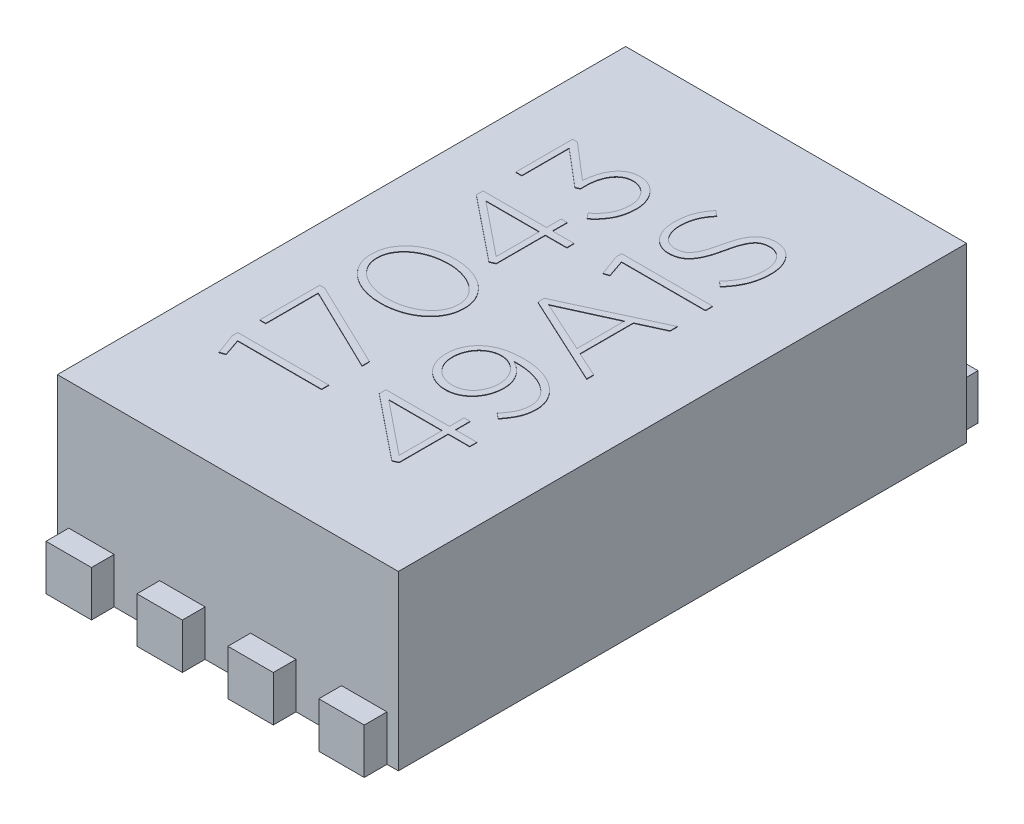
from build123d import *

# Parameters (mm, degrees)
SKETCH1_W           = 1.905
SKETCH1_H           = 3.175
BOSS_EXTRUDE1_DEPTH = 0.9652
SKETCH2_W           = 0.254
SKETCH2_H           = 0.254
BOSS_EXTRUDE2_DEPTH = 0.127
BOSS_EXTRUDE3_DEPTH = 0.00254


with BuildPart() as part:
    # Sketch1 → Boss-Extrude1 (new body)
    with BuildSketch(Plane(origin=(0, 0, 0), x_dir=(1, 0, 0), z_dir=(0, 1, 0))):
        Rectangle(SKETCH1_W, SKETCH1_H)
    extrude(amount=BOSS_EXTRUDE1_DEPTH)

    # Sketch2 → Boss-Extrude2 (add)
    with BuildSketch(Plane.XY.offset(1.5875)):
        with Locations((-0.762, 0.127)):
            Rectangle(SKETCH2_W, SKETCH2_H)
        with Locations((-0.254, 0.127)):
            Rectangle(SKETCH2_W, SKETCH2_H)
        with Locations((0.254, 0.127)):
            Rectangle(SKETCH2_W, SKETCH2_H)
        with Locations((0.762, 0.127)):
            Rectangle(SKETCH2_W, SKETCH2_H)
    boss_extrude2 = extrude(amount=BOSS_EXTRUDE2_DEPTH)

    # Mirror1: Boss-Extrude2 across plane
    add(boss_extrude2.mirror(Plane.XY))

    # Sketch3 → Boss-Extrude3 (add)
    # profile 1 of 10: a face of its own
    with BuildSketch(Plane(origin=(0, 0.9652, 0), x_dir=(1, 0, 0), z_dir=(0, 1, 0))):
        Polygon((-0.610505972, -0.922421053), (-0.577293801, -1.019864309), (-0.606850545, -1.029995066), (-0.649462387, -0.913752467), (-0.649462387, -0.882315789), (-0.141462387, -0.882315789), (-0.141462387, -0.922421053), align=None)
    # profile 2 of 10: a face of its own
    with BuildSketch(Plane(origin=(0, 0.9652, 0), x_dir=(1, 0, 0), z_dir=(0, 1, 0))):
        Polygon((-0.616041334, -0.466641447), (-0.616041334, -0.759702303), (-0.649462387, -0.759702303), (-0.649462387, -0.424760691), (-0.621890018, -0.424760691), (-0.141462387, -0.655052632), (-0.141462387, -0.696202303), align=None)
    # profile 3 of 10: a face of its own
    with BuildSketch(Plane(origin=(0, 0.9652, 0), x_dir=(1, 0, 0), z_dir=(0, 1, 0))):
        with BuildLine():
            add(Edge.make_bspline(
                [(-0.134778176, -0.131073191), (-0.134985946, -0.138995189), (-0.135393274, -0.154526071), (-0.139575216, -0.177158237), (-0.145938838, -0.198666452), (-0.155274919, -0.218747049), (-0.166706269, -0.237440209), (-0.179953796, -0.254852705), (-0.195136491, -0.270736797), (-0.212129513, -0.285058077), (-0.230738412, -0.297831511), (-0.250787447, -0.309116717), (-0.272341137, -0.318743469), (-0.295135788, -0.32669989), (-0.318896259, -0.333103481), (-0.343424456, -0.337534553), (-0.368520942, -0.340343484), (-0.385463471, -0.340710041), (-0.394000216, -0.340894737)],
                knots=[0, 0, 0, 0, 1.021048874, 2.001741057, 2.959440883, 3.908123775, 4.849483788, 5.782004241, 6.725579915, 7.678559664, 8.64415859, 9.633647405, 10.642930682, 11.685653277, 12.745789764, 13.814456005, 14.898781227, 16, 16, 16, 16], degree=3))
            Line((-0.394000216, -0.340894737), (-0.395462387, -0.340894737))
            add(Edge.make_bspline(
                [(-0.395462387, -0.340894737), (-0.403999736, -0.340717614), (-0.420981891, -0.340365289), (-0.446147785, -0.337430896), (-0.47083629, -0.332855038), (-0.494814242, -0.326451352), (-0.517748672, -0.318204595), (-0.539397375, -0.308418706), (-0.559470827, -0.296850085), (-0.578174818, -0.283949742), (-0.595094912, -0.269372102), (-0.610393477, -0.25347287), (-0.623644674, -0.235959959), (-0.635360911, -0.217327312), (-0.64475705, -0.197203548), (-0.65128088, -0.175715858), (-0.655392504, -0.15305806), (-0.655891857, -0.137531667), (-0.656146597, -0.12961102)],
                knots=[0, 0, 0, 0, 1.096222778, 2.180562826, 3.249592639, 4.319033819, 5.364233402, 6.376698445, 7.366113132, 8.336100033, 9.290555337, 10.229850209, 11.164407819, 12.106179152, 13.052429817, 14.007094568, 14.98333756, 16, 16, 16, 16], degree=3))
            add(Edge.make_bspline(
                [(-0.656146597, -0.12961102), (-0.655874869, -0.121693731), (-0.655341244, -0.106145585), (-0.651465207, -0.083445593), (-0.644788249, -0.062040336), (-0.635689141, -0.041906193), (-0.624206096, -0.023248911), (-0.611004254, -0.005869499), (-0.595857302, 0.009982987), (-0.578858223, 0.024295176), (-0.56024998, 0.037098012), (-0.540222687, 0.048461037), (-0.518685112, 0.05805269), (-0.495864575, 0.066036568), (-0.472058696, 0.072402496), (-0.447501117, 0.07685327), (-0.422403627, 0.079658523), (-0.405461234, 0.08002558), (-0.396924558, 0.080210526)],
                knots=[0, 0, 0, 0, 1.021334821, 2.005719747, 2.960480962, 3.907337291, 4.848733233, 5.781289277, 6.718550215, 7.671566337, 8.643450498, 9.629064498, 10.638386295, 11.681148687, 12.745665563, 13.81437259, 14.898739198, 16, 16, 16, 16], degree=3))
            Line((-0.396924558, 0.080210526), (-0.395462387, 0.080210526))
            add(Edge.make_bspline(
                [(-0.395462387, 0.080210526), (-0.386924746, 0.080034493), (-0.369942011, 0.079684334), (-0.34478041, 0.076733907), (-0.320099959, 0.072222423), (-0.296172697, 0.065597874), (-0.273227482, 0.057423738), (-0.251502563, 0.047752778), (-0.231457029, 0.036159337), (-0.212749612, 0.023266935), (-0.195828267, 0.008688633), (-0.180537878, -0.007215591), (-0.167266457, -0.024693411), (-0.155675765, -0.043386678), (-0.146319961, -0.063469285), (-0.139579231, -0.084904939), (-0.135553242, -0.107596729), (-0.135039619, -0.123154191), (-0.134778176, -0.131073191)],
                knots=[0, 0, 0, 0, 1.096336923, 2.180789878, 3.249931005, 4.316337847, 5.365856055, 6.376578305, 7.366096015, 8.336183917, 9.290738604, 10.230131281, 11.164786202, 12.104306594, 13.050655788, 14.00248317, 14.983231699, 16, 16, 16, 16], degree=3))
        make_face()
        with BuildLine():
            add(Edge.make_bspline(
                [(-0.168199229, -0.12961102), (-0.168400432, -0.123256589), (-0.168796191, -0.110757625), (-0.172512027, -0.092535103), (-0.178324661, -0.075203262), (-0.186714231, -0.059022885), (-0.196884296, -0.043885216), (-0.208610262, -0.029770825), (-0.222109792, -0.01701095), (-0.237056529, -0.00540985), (-0.253425086, 0.004871185), (-0.270871239, 0.014127427), (-0.289592828, 0.02195357), (-0.309332573, 0.028465042), (-0.329852898, 0.033674841), (-0.350858085, 0.037442764), (-0.372296771, 0.039690301), (-0.386718853, 0.039966046), (-0.394000216, 0.040105263)],
                knots=[0, 0, 0, 0, 0.971998841, 1.911890973, 2.835726599, 3.763154361, 4.693152536, 5.624158575, 6.566813259, 7.531843225, 8.516795651, 9.523098662, 10.552795509, 11.619899711, 12.70338974, 13.791956286, 14.885211918, 16, 16, 16, 16], degree=3))
            Line((-0.394000216, 0.040105263), (-0.395462387, 0.040105263))
            add(Edge.make_bspline(
                [(-0.395462387, 0.040105263), (-0.402743629, 0.039964791), (-0.417200111, 0.039685893), (-0.438708948, 0.037445187), (-0.459849056, 0.033660251), (-0.480515039, 0.028479891), (-0.500439198, 0.021951412), (-0.519293517, 0.014034141), (-0.536885436, 0.00470017), (-0.553249138, -0.005834789), (-0.568160696, -0.017641563), (-0.581737713, -0.030529966), (-0.593471743, -0.044848708), (-0.603916483, -0.060027411), (-0.612383375, -0.076353885), (-0.618302622, -0.093782518), (-0.622155633, -0.112105114), (-0.622533533, -0.124682582), (-0.622725545, -0.131073191)],
                knots=[0, 0, 0, 0, 1.107273849, 2.19842768, 3.284869194, 4.371323612, 5.436262208, 6.470833719, 7.477509033, 8.461537381, 9.426592335, 10.36655408, 11.30280988, 12.23684706, 13.165148402, 14.089484759, 15.029267521, 16, 16, 16, 16], degree=3))
            add(Edge.make_bspline(
                [(-0.622725545, -0.131073191), (-0.62252351, -0.137427186), (-0.622126113, -0.149925294), (-0.618422174, -0.168154038), (-0.612570389, -0.185447828), (-0.604347666, -0.201719286), (-0.594056551, -0.216760168), (-0.582255086, -0.230821002), (-0.568861712, -0.243644177), (-0.553959197, -0.255303472), (-0.53759999, -0.265547975), (-0.520136246, -0.274841924), (-0.50138368, -0.282592965), (-0.481668262, -0.289160312), (-0.46115584, -0.294413937), (-0.440079969, -0.297940202), (-0.418637304, -0.300421209), (-0.404207816, -0.300665944), (-0.396924558, -0.300789474)],
                knots=[0, 0, 0, 0, 0.971956183, 1.911807067, 2.83560215, 3.760580748, 4.693512614, 5.620393957, 6.566692983, 7.527475195, 8.512384395, 9.518643244, 10.553209405, 11.615208307, 12.698650787, 13.791494471, 14.885260842, 16, 16, 16, 16], degree=3))
            Line((-0.396924558, -0.300789474), (-0.395462387, -0.300789474))
            add(Edge.make_bspline(
                [(-0.395462387, -0.300789474), (-0.388179172, -0.300665494), (-0.373749771, -0.300419866), (-0.352340577, -0.297949392), (-0.331300577, -0.294406592), (-0.310800614, -0.289128661), (-0.290997064, -0.282656644), (-0.272243242, -0.274642628), (-0.254532157, -0.265516106), (-0.238101117, -0.254945658), (-0.223039123, -0.243121239), (-0.209334286, -0.230188579), (-0.197446113, -0.215869336), (-0.18701646, -0.200651754), (-0.178512978, -0.184305861), (-0.172659129, -0.166856132), (-0.168755751, -0.14854784), (-0.168387067, -0.136002612), (-0.168199229, -0.12961102)],
                knots=[0, 0, 0, 0, 1.107665828, 2.194491947, 3.275182509, 4.351750245, 5.41203684, 6.442096919, 7.451355009, 8.440182223, 9.409740304, 10.36135003, 11.301331171, 12.235699005, 13.164328968, 14.0940007, 15.028923878, 16, 16, 16, 16], degree=3))
        make_face(mode=Mode.SUBTRACT)
    # profile 4 of 10: a face of its own
    with BuildSketch(Plane(origin=(0, 0.9652, 0), x_dir=(1, 0, 0), z_dir=(0, 1, 0))):
        Polygon((-0.261778176, 0.447842105), (-0.261778176, 0.174207237), (-0.29008163, 0.161256579), (-0.649462387, 0.450244243), (-0.649462387, 0.487947368), (-0.295199229, 0.487947368), (-0.295199229, 0.570246711), (-0.261778176, 0.570246711), (-0.261778176, 0.487947368), (-0.141462387, 0.487947368), (-0.141462387, 0.447842105), align=None)
        Polygon((-0.295199229, 0.447842105), (-0.594108768, 0.447842105), (-0.295199229, 0.206688322), align=None, mode=Mode.SUBTRACT)
    # profile 5 of 10: a face of its own
    with BuildSketch(Plane(origin=(0, 0.9652, 0), x_dir=(1, 0, 0), z_dir=(0, 1, 0))):
        with BuildLine():
            add(Edge.make_bspline(
                [(-0.134778176, 0.830304276), (-0.134867002, 0.825219697), (-0.135042446, 0.815176887), (-0.136175177, 0.800350138), (-0.138189371, 0.786027667), (-0.140850993, 0.772195239), (-0.144464281, 0.758893557), (-0.148689746, 0.746021318), (-0.153840591, 0.733688223), (-0.161617326, 0.718024636), (-0.172888349, 0.699658447), (-0.188257588, 0.679252694), (-0.205685459, 0.660789534), (-0.21869924, 0.650081587), (-0.2252239, 0.644712993)],
                knots=[0, 0, 0, 0, 0.854271504, 1.687314925, 2.496294613, 3.283194386, 4.052173996, 4.81051404, 5.55783425, 6.295478513, 7.746980402, 9.170639424, 10.581456551, 12, 12, 12, 12], degree=3))
            Line((-0.2252239, 0.644712993), (-0.2490364, 0.673643092))
            add(Edge.make_bspline(
                [(-0.2490364, 0.673643092), (-0.242797709, 0.678740743), (-0.230567899, 0.688733753), (-0.214427255, 0.705586165), (-0.200540932, 0.723442203), (-0.188792354, 0.742345209), (-0.179493171, 0.762555595), (-0.172894428, 0.784147866), (-0.168982917, 0.80715069), (-0.168464742, 0.822943253), (-0.168199229, 0.831035362)],
                knots=[0, 0, 0, 0, 1.051624329, 2.061516695, 3.040294683, 4.001988714, 4.962466983, 5.937752461, 6.943304406, 8, 8, 8, 8], degree=3))
            add(Edge.make_bspline(
                [(-0.168199229, 0.831035362), (-0.168293367, 0.835184146), (-0.168479952, 0.843407199), (-0.170165499, 0.85558325), (-0.172549831, 0.867510905), (-0.176322248, 0.878982874), (-0.180706509, 0.889983545), (-0.186013794, 0.900290874), (-0.191896524, 0.909954103), (-0.198768176, 0.918742821), (-0.20627827, 0.9268256), (-0.214590728, 0.934094993), (-0.223692386, 0.940468124), (-0.233522668, 0.945911033), (-0.243987999, 0.95029971), (-0.255031239, 0.953604773), (-0.266726239, 0.955492832), (-0.27472216, 0.955724102), (-0.278802025, 0.955842105)],
                knots=[0, 0, 0, 0, 1.071579575, 2.123913014, 3.172045966, 4.210597515, 5.239753758, 6.229579871, 7.203287384, 8.158870018, 9.107310552, 10.051002544, 11.006966285, 11.97345626, 12.949281299, 13.934270765, 14.945975694, 16, 16, 16, 16], degree=3))
            Line((-0.278802025, 0.955842105), (-0.280264196, 0.955842105))
            add(Edge.make_bspline(
                [(-0.280264196, 0.955842105), (-0.284555501, 0.955707495), (-0.292918761, 0.955445156), (-0.305059697, 0.953232066), (-0.316369607, 0.949429391), (-0.326834587, 0.944158344), (-0.336547689, 0.937655973), (-0.345306052, 0.929784746), (-0.353534408, 0.921029759), (-0.360836765, 0.911037766), (-0.367269945, 0.900004192), (-0.37309996, 0.888076865), (-0.377821071, 0.875015622), (-0.381900393, 0.861111472), (-0.385011227, 0.846372838), (-0.387150839, 0.830980468), (-0.388579316, 0.814978431), (-0.388711117, 0.804092824), (-0.388778176, 0.798554276)],
                knots=[0, 0, 0, 0, 0.96348038, 1.87771215, 2.760599961, 3.634960617, 4.502580198, 5.378059321, 6.274524208, 7.197378641, 8.151001125, 9.140876251, 10.175197234, 11.266629109, 12.394005205, 13.555293097, 14.756143983, 16, 16, 16, 16], degree=3))
            Line((-0.388778176, 0.798554276), (-0.388778176, 0.771086349))
            Line((-0.388778176, 0.771086349), (-0.410292979, 0.761686678))
            Line((-0.410292979, 0.761686678), (-0.616041334, 0.935685033))
            Line((-0.616041334, 0.935685033), (-0.616041334, 0.67071875))
            Line((-0.616041334, 0.67071875), (-0.649462387, 0.67071875))
            Line((-0.649462387, 0.67071875), (-0.649462387, 0.987800987))
            Line((-0.649462387, 0.987800987), (-0.622203341, 0.987800987))
            Line((-0.622203341, 0.987800987), (-0.422199229, 0.815787007))
            add(Edge.make_bspline(
                [(-0.422199229, 0.815787007), (-0.42173515, 0.821745616), (-0.420817997, 0.833521525), (-0.418440916, 0.850940754), (-0.414928485, 0.86786225), (-0.410715985, 0.884313074), (-0.405583515, 0.900073227), (-0.399240673, 0.91482587), (-0.392160146, 0.928692023), (-0.384113429, 0.941594413), (-0.375081675, 0.953439558), (-0.364820744, 0.963998475), (-0.353513315, 0.973268284), (-0.341259689, 0.98145032), (-0.327814179, 0.987939281), (-0.313259771, 0.992711481), (-0.297596194, 0.995399101), (-0.286819102, 0.995761876), (-0.281308604, 0.995947368)],
                knots=[0, 0, 0, 0, 1.129077432, 2.231378806, 3.318822516, 4.392492957, 5.438734542, 6.446643788, 7.423313533, 8.377804221, 9.315835361, 10.232192388, 11.152694783, 12.073972357, 13.009463343, 13.964203295, 14.959064901, 16, 16, 16, 16], degree=3))
            Line((-0.281308604, 0.995947368), (-0.279950874, 0.995947368))
            add(Edge.make_bspline(
                [(-0.279950874, 0.995947368), (-0.274612313, 0.995803964), (-0.264112347, 0.995521914), (-0.248770236, 0.992782266), (-0.23413713, 0.988578214), (-0.220441855, 0.982405122), (-0.207585945, 0.974944502), (-0.195488028, 0.96642286), (-0.184530835, 0.956503503), (-0.174452731, 0.945604586), (-0.165390889, 0.933719257), (-0.157381272, 0.92090344), (-0.150635777, 0.9071489), (-0.144865665, 0.89267855), (-0.140436713, 0.877593613), (-0.137177341, 0.862128989), (-0.135107269, 0.84634001), (-0.134888333, 0.835671883), (-0.134778176, 0.830304276)],
                knots=[0, 0, 0, 0, 1.044950902, 2.05522634, 3.043647224, 4.020779072, 4.989423835, 5.952747326, 6.913943739, 7.879269157, 8.85735268, 9.837692728, 10.835108811, 11.854665746, 12.886197601, 13.910851897, 14.948857301, 16, 16, 16, 16], degree=3))
        make_face()
    # profile 6 of 10: a face of its own
    with BuildSketch(Plane(origin=(0, 0.9652, 0), x_dir=(1, 0, 0), z_dir=(0, 1, 0))):
        Polygon((0.42900315, -0.785394737), (0.42900315, -1.059029605), (0.400699696, -1.071980263), (0.04131894, -0.782992599), (0.04131894, -0.745289474), (0.395582098, -0.745289474), (0.395582098, -0.662990132), (0.42900315, -0.662990132), (0.42900315, -0.745289474), (0.54931894, -0.745289474), (0.54931894, -0.785394737), align=None)
        Polygon((0.395582098, -0.785394737), (0.096672558, -0.785394737), (0.395582098, -1.02654852), align=None, mode=Mode.SUBTRACT)
    # profile 7 of 10: a face of its own
    with BuildSketch(Plane(origin=(0, 0.9652, 0), x_dir=(1, 0, 0), z_dir=(0, 1, 0))):
        with BuildLine():
            add(Edge.make_bspline(
                [(0.55600315, -0.418912007), (0.555788983, -0.426619426), (0.555371128, -0.441657157), (0.55192798, -0.463505303), (0.546523937, -0.484044169), (0.538422694, -0.503058187), (0.528917712, -0.521056137), (0.518359796, -0.538435194), (0.506642015, -0.55519409), (0.498065823, -0.565838202), (0.49375644, -0.571186678)],
                knots=[0, 0, 0, 0, 1.099009896, 2.144247589, 3.147899211, 4.121001419, 5.085164562, 6.050261124, 7.020291078, 8, 8, 8, 8], degree=3))
            Line((0.49375644, -0.571186678), (0.464826341, -0.547374178))
            add(Edge.make_bspline(
                [(0.464826341, -0.547374178), (0.469429137, -0.542040524), (0.478346081, -0.531707699), (0.490059943, -0.515648096), (0.500034267, -0.499858281), (0.50838724, -0.484193501), (0.5146661, -0.468232399), (0.519381212, -0.452003096), (0.521991135, -0.435219521), (0.522383785, -0.423898671), (0.522582098, -0.418180921)],
                knots=[0, 0, 0, 0, 1.166578334, 2.259998627, 3.288750388, 4.258584942, 5.195563713, 6.124701817, 7.05285518, 8, 8, 8, 8], degree=3))
            add(Edge.make_bspline(
                [(0.522582098, -0.418180921), (0.522339535, -0.411930998), (0.521859652, -0.399566213), (0.518085819, -0.381493559), (0.511992742, -0.364210033), (0.503306491, -0.347936485), (0.492663528, -0.332570566), (0.479990604, -0.318347786), (0.465368048, -0.305374702), (0.448920533, -0.293608693), (0.430813341, -0.28299926), (0.41091851, -0.273971047), (0.389485958, -0.26613286), (0.366505785, -0.259716389), (0.342167198, -0.254648037), (0.316533218, -0.251490398), (0.289729512, -0.249964617), (0.271507388, -0.250423693), (0.262211209, -0.250657895)],
                knots=[0, 0, 0, 0, 0.868006066, 1.717254597, 2.554342617, 3.407043532, 4.272727134, 5.146646299, 6.047889427, 6.983804171, 7.953042507, 8.959718696, 10.015873201, 11.121769014, 12.272774416, 13.467618061, 14.708082809, 16, 16, 16, 16], degree=3))
            add(Edge.make_bspline(
                [(0.262211209, -0.250657895), (0.268803567, -0.25439114), (0.282095791, -0.261918512), (0.29750446, -0.27336064), (0.309182874, -0.283456838), (0.317479075, -0.291631731), (0.32518657, -0.300394368), (0.332342863, -0.309722659), (0.338786659, -0.319665238), (0.344693889, -0.330127768), (0.349802659, -0.341242972), (0.354189496, -0.352928428), (0.357778835, -0.365238516), (0.36041284, -0.378188901), (0.36183944, -0.391829602), (0.362052423, -0.40111917), (0.362161045, -0.405856908)],
                knots=[0, 0, 0, 0, 1.632992267, 3.292615584, 4.128309955, 4.961977577, 5.802616828, 6.643691982, 7.495559133, 8.356217987, 9.233135799, 10.131368654, 11.046302244, 11.996191627, 12.978045202, 14, 14, 14, 14], degree=3))
            add(Edge.make_bspline(
                [(0.362161045, -0.405856908), (0.36203581, -0.41202684), (0.361789384, -0.424167443), (0.359389983, -0.441986203), (0.355690248, -0.459060356), (0.350420986, -0.475253066), (0.343984361, -0.49056086), (0.336221209, -0.504756068), (0.327421764, -0.517968002), (0.317391382, -0.529925361), (0.306392943, -0.540761166), (0.294387973, -0.55029841), (0.281553332, -0.55868735), (0.267835255, -0.565699329), (0.253414654, -0.571246584), (0.238360354, -0.575224837), (0.222744246, -0.577694286), (0.212123483, -0.578019678), (0.20675315, -0.578184211)],
                knots=[0, 0, 0, 0, 1.142927878, 2.248944502, 3.325994144, 4.376827604, 5.40026555, 6.399249087, 7.370960484, 8.337517104, 9.286535453, 10.227690973, 11.174403504, 12.123772724, 13.077582413, 14.032264635, 15.005025107, 16, 16, 16, 16], degree=3))
            Line((0.20675315, -0.578184211), (0.205290979, -0.578184211))
            add(Edge.make_bspline(
                [(0.205290979, -0.578184211), (0.199538647, -0.578018113), (0.188157569, -0.577689487), (0.171318852, -0.575229589), (0.154960586, -0.571124999), (0.139116919, -0.565495475), (0.123981117, -0.558435291), (0.10982072, -0.549896403), (0.096608866, -0.540174674), (0.084436464, -0.529179659), (0.073455178, -0.516895567), (0.063617664, -0.503505553), (0.055006154, -0.488993069), (0.047684297, -0.473413802), (0.041800816, -0.456776642), (0.037671109, -0.439162063), (0.035085431, -0.420659778), (0.034787031, -0.408024065), (0.034634729, -0.401574836)],
                knots=[0, 0, 0, 0, 1.006957659, 1.992281052, 2.972462474, 3.955728526, 4.931959578, 5.891626713, 6.846227761, 7.799972106, 8.758244375, 9.726276879, 10.704769951, 11.708253038, 12.735811435, 13.788501064, 14.871257679, 16, 16, 16, 16], degree=3))
            add(Edge.make_bspline(
                [(0.034634729, -0.401574836), (0.034762149, -0.394913598), (0.035010791, -0.381915161), (0.037905886, -0.363055402), (0.042022445, -0.345234634), (0.048330545, -0.328678689), (0.055948291, -0.313219952), (0.06477045, -0.298888461), (0.07454557, -0.285561616), (0.082067497, -0.277667664), (0.085810716, -0.273739309)],
                knots=[0, 0, 0, 0, 1.129293469, 2.203652218, 3.23095411, 4.227267122, 5.202123363, 6.151444167, 7.080082873, 8, 8, 8, 8], degree=3))
            add(Edge.make_bspline(
                [(0.085810716, -0.273739309), (0.090827868, -0.269026004), (0.1010318, -0.259440037), (0.115497587, -0.24917815), (0.128100838, -0.241728126), (0.138256769, -0.236361274), (0.149223587, -0.231744834), (0.160753999, -0.227290223), (0.173042949, -0.223309047), (0.186185256, -0.220028293), (0.200075238, -0.21707368), (0.214821239, -0.214696728), (0.230430583, -0.212829214), (0.246941227, -0.211451834), (0.264364149, -0.210782596), (0.276275478, -0.210630454), (0.282368282, -0.210552632)],
                knots=[0, 0, 0, 0, 1.36137028, 2.768767971, 3.497908331, 4.259161636, 5.039997446, 5.851340597, 6.705559102, 7.594666812, 8.531212599, 9.515635712, 10.549807531, 11.642209477, 12.793958774, 14, 14, 14, 14], degree=3))
            Line((0.282368282, -0.210552632), (0.283830453, -0.210552632))
            add(Edge.make_bspline(
                [(0.283830453, -0.210552632), (0.29358766, -0.21074185), (0.312736251, -0.211113194), (0.340767767, -0.214363204), (0.367600381, -0.219370865), (0.393008441, -0.226766542), (0.417027269, -0.235709062), (0.43947482, -0.246147826), (0.460216618, -0.25808722), (0.479304891, -0.271350196), (0.496552828, -0.285930512), (0.511834718, -0.301804405), (0.525054333, -0.31888182), (0.536170603, -0.337074761), (0.545025888, -0.356303394), (0.551422541, -0.376422754), (0.555303239, -0.39742195), (0.555767911, -0.411689233), (0.55600315, -0.418912007)],
                knots=[0, 0, 0, 0, 1.230396351, 2.414661871, 3.554974421, 4.669716749, 5.748053625, 6.785371207, 7.78870504, 8.763305362, 9.713579913, 10.632919843, 11.537659183, 12.432399557, 13.316657273, 14.201351068, 15.089438924, 16, 16, 16, 16], degree=3))
        make_face()
        with BuildLine():
            add(Edge.make_bspline(
                [(0.328739992, -0.39948602), (0.328597372, -0.394152631), (0.328318452, -0.3837222), (0.326197147, -0.368459471), (0.322680452, -0.354031261), (0.317711418, -0.340486912), (0.311645102, -0.327855529), (0.304665156, -0.316132398), (0.296743567, -0.305404915), (0.288112112, -0.295582214), (0.278710069, -0.28678946), (0.268593152, -0.279098779), (0.257851298, -0.272513441), (0.246514004, -0.267119544), (0.234916412, -0.262666365), (0.223050499, -0.259717729), (0.211139534, -0.257687046), (0.203140991, -0.25745733), (0.199128973, -0.257342105)],
                knots=[0, 0, 0, 0, 1.197831748, 2.34258199, 3.454124339, 4.527881334, 5.577295426, 6.597990225, 7.588146042, 8.568867451, 9.531681962, 10.474889345, 11.419166106, 12.356616915, 13.292108305, 14.204495941, 15.099386472, 16, 16, 16, 16], degree=3))
            Line((0.199128973, -0.257342105), (0.197666801, -0.257342105))
            add(Edge.make_bspline(
                [(0.197666801, -0.257342105), (0.193238669, -0.257497522), (0.184477583, -0.257805015), (0.171503139, -0.25981397), (0.158964801, -0.263264174), (0.146945405, -0.268096381), (0.135586726, -0.274080742), (0.124803514, -0.280965276), (0.114922433, -0.289088114), (0.10563984, -0.29803314), (0.097414661, -0.308164037), (0.089918539, -0.319160668), (0.083486243, -0.331231228), (0.077908735, -0.344165844), (0.073619013, -0.357904932), (0.070278527, -0.372233174), (0.068421541, -0.387147548), (0.068178534, -0.39728801), (0.068055782, -0.402410362)],
                knots=[0, 0, 0, 0, 0.98046618, 1.939857778, 2.899218408, 3.85398461, 4.802162155, 5.738674229, 6.681320796, 7.629811633, 8.58818074, 9.56524715, 10.572350965, 11.611856617, 12.679644669, 13.754891426, 14.865906145, 16, 16, 16, 16], degree=3))
            add(Edge.make_bspline(
                [(0.068055782, -0.402410362), (0.068198434, -0.407535064), (0.068477211, -0.417549935), (0.070594447, -0.432191447), (0.074136182, -0.446023234), (0.079065129, -0.458991962), (0.085163025, -0.471079061), (0.092258812, -0.482190905), (0.100159918, -0.492497623), (0.109028187, -0.501764653), (0.118771615, -0.510043289), (0.129299594, -0.517263044), (0.140516614, -0.523611319), (0.152495684, -0.528725211), (0.164898725, -0.532982505), (0.177620347, -0.535821509), (0.190508649, -0.537711236), (0.19915706, -0.537955732), (0.203515486, -0.538078947)],
                knots=[0, 0, 0, 0, 1.14951129, 2.246415069, 3.311114252, 4.346912692, 5.352950193, 6.343217722, 7.300943857, 8.262230798, 9.215359209, 10.164349909, 11.122553705, 12.102042322, 13.082651494, 14.060363273, 15.022506651, 16, 16, 16, 16], degree=3))
            Line((0.203515486, -0.538078947), (0.204977657, -0.538078947))
            add(Edge.make_bspline(
                [(0.204977657, -0.538078947), (0.209369636, -0.537956236), (0.218055339, -0.537713557), (0.230793221, -0.535861268), (0.24292813, -0.532505454), (0.254542996, -0.5282142), (0.265418313, -0.522496278), (0.275608729, -0.515790022), (0.285053012, -0.508043958), (0.293628685, -0.499220344), (0.301361617, -0.489471324), (0.308272947, -0.478872654), (0.31433497, -0.467484486), (0.319458671, -0.455283922), (0.323680291, -0.442385227), (0.326554576, -0.428691496), (0.328379984, -0.414331105), (0.32861828, -0.404504889), (0.328739992, -0.39948602)],
                knots=[0, 0, 0, 0, 1.014777876, 2.006853222, 2.965014428, 3.919758633, 4.862462965, 5.79734303, 6.734677353, 7.679027852, 8.635126785, 9.605736304, 10.599017742, 11.612040304, 12.660197183, 13.729987982, 14.84056138, 16, 16, 16, 16], degree=3))
        make_face(mode=Mode.SUBTRACT)
    # profile 8 of 10: a face of its own
    with BuildSketch(Plane(origin=(0, 0.9652, 0), x_dir=(1, 0, 0), z_dir=(0, 1, 0))):
        Polygon((0.04131894, 0.103291941), (0.04131894, 0.139428454), (0.54931894, 0.374733553), (0.54931894, 0.333583882), (0.408950519, 0.269352796), (0.408950519, -0.028721217), (0.54931894, -0.093056743), (0.54931894, -0.132013158), align=None)
        Polygon((0.375529466, 0.253477796), (0.083199696, 0.120629112), (0.375529466, -0.012846217), align=None, mode=Mode.SUBTRACT)
    # profile 9 of 10: a face of its own
    with BuildSketch(Plane(origin=(0, 0.9652, 0), x_dir=(1, 0, 0), z_dir=(0, 1, 0))):
        Polygon((0.080275354, 0.531394737), (0.113487525, 0.43395148), (0.083930782, 0.423820724), (0.04131894, 0.540063322), (0.04131894, 0.5715), (0.54931894, 0.5715), (0.54931894, 0.531394737), align=None)
    # profile 10 of 10: a face of its own
    with BuildSketch(Plane(origin=(0, 0.9652, 0), x_dir=(1, 0, 0), z_dir=(0, 1, 0))):
        with BuildLine():
            add(Edge.make_bspline(
                [(0.55600315, 0.891402138), (0.555779601, 0.881501389), (0.555342613, 0.862147645), (0.551420034, 0.833874591), (0.545413543, 0.807016278), (0.536455553, 0.781545543), (0.525005804, 0.757090688), (0.511134532, 0.73318964), (0.494709763, 0.709704709), (0.482114016, 0.694885161), (0.475688183, 0.687324836)],
                knots=[0, 0, 0, 0, 1.057012815, 2.066222908, 3.043128535, 3.992177125, 4.943779321, 5.923448257, 6.940628544, 8, 8, 8, 8], degree=3))
            Line((0.475688183, 0.687324836), (0.44748917, 0.711868421))
            add(Edge.make_bspline(
                [(0.44748917, 0.711868421), (0.453659413, 0.718666401), (0.465597495, 0.73181902), (0.481166011, 0.752563138), (0.494234926, 0.773453655), (0.504530629, 0.794997599), (0.512590813, 0.817273849), (0.517305961, 0.836610389), (0.520123728, 0.852706765), (0.521548961, 0.865402855), (0.522386027, 0.87864898), (0.522515773, 0.887641024), (0.522582098, 0.892237664)],
                knots=[0, 0, 0, 0, 1.371414131, 2.653389148, 3.870559708, 5.048053164, 6.214888994, 7.404834091, 8.017265778, 8.656175337, 9.31305055, 10, 10, 10, 10], degree=3))
            add(Edge.make_bspline(
                [(0.522582098, 0.892237664), (0.522463979, 0.896800816), (0.522230833, 0.905807668), (0.520921522, 0.919057337), (0.518484133, 0.931762498), (0.515167336, 0.943848289), (0.510990963, 0.955229457), (0.506109159, 0.965805218), (0.500467518, 0.975479581), (0.494037385, 0.984180162), (0.487048434, 0.992052574), (0.479379517, 0.999039419), (0.470962325, 1.004939098), (0.462104662, 1.010133649), (0.452626933, 1.014193093), (0.442746104, 1.017292135), (0.432364498, 1.018931787), (0.425352719, 1.019204036), (0.421796736, 1.019342105)],
                knots=[0, 0, 0, 0, 1.209884047, 2.388096214, 3.524804791, 4.635361213, 5.706923452, 6.735039734, 7.719566387, 8.67020191, 9.598351166, 10.50660274, 11.413164717, 12.318645578, 13.223891244, 14.140590549, 15.057011067, 16, 16, 16, 16], degree=3))
            Line((0.421796736, 1.019342105), (0.420334565, 1.019342105))
            add(Edge.make_bspline(
                [(0.420334565, 1.019342105), (0.41705869, 1.019256836), (0.410625858, 1.019089392), (0.401259457, 1.01792919), (0.392398154, 1.01607221), (0.384021388, 1.013360889), (0.376101904, 1.009562566), (0.368557505, 1.004567997), (0.361464799, 0.998242184), (0.354735566, 0.990612418), (0.348372641, 0.98166707), (0.342331321, 0.971377655), (0.336587396, 0.959715178), (0.331139749, 0.946566497), (0.326035381, 0.931695502), (0.321111213, 0.914944471), (0.316616883, 0.896158467), (0.313809262, 0.882948931), (0.312342788, 0.876049342)],
                knots=[0, 0, 0, 0, 0.796108402, 1.563317649, 2.290226045, 2.993963057, 3.697903519, 4.418381161, 5.18573038, 6.000857781, 6.886134874, 7.84971538, 8.897927318, 10.043495362, 11.306568763, 12.717624571, 14.285553433, 16, 16, 16, 16], degree=3))
            add(Edge.make_bspline(
                [(0.312342788, 0.876049342), (0.310762898, 0.868690566), (0.307709912, 0.854470439), (0.302374114, 0.834088392), (0.296651012, 0.81533153), (0.290491347, 0.798180267), (0.283993486, 0.78251301), (0.276711394, 0.768455343), (0.269062016, 0.755783567), (0.260772626, 0.744594654), (0.251868306, 0.734901777), (0.24227402, 0.726642716), (0.231980741, 0.71982852), (0.221018216, 0.714315484), (0.209237268, 0.710239376), (0.196699989, 0.707361858), (0.183341566, 0.705539366), (0.174173642, 0.705304676), (0.169467788, 0.705184211)],
                knots=[0, 0, 0, 0, 1.472473983, 2.845414657, 4.120951049, 5.30814638, 6.410070276, 7.436726935, 8.402847546, 9.303346438, 10.156539609, 10.972938779, 11.77396204, 12.565985573, 13.367385248, 14.206734749, 15.079524957, 16, 16, 16, 16], degree=3))
            Line((0.169467788, 0.705184211), (0.168005617, 0.705184211))
            add(Edge.make_bspline(
                [(0.168005617, 0.705184211), (0.163362602, 0.705298048), (0.154185832, 0.705523044), (0.140764348, 0.708120355), (0.127735321, 0.711788979), (0.115353456, 0.717318044), (0.103524661, 0.724064485), (0.092561279, 0.732210809), (0.08220891, 0.7413295), (0.072751794, 0.751675581), (0.064132729, 0.763081799), (0.056648735, 0.775593905), (0.050010384, 0.789013856), (0.044503943, 0.803423139), (0.040146967, 0.818700114), (0.036858814, 0.834747871), (0.034992514, 0.851565672), (0.034755218, 0.863024598), (0.034634729, 0.868842928)],
                knots=[0, 0, 0, 0, 0.946892415, 1.871502523, 2.782675858, 3.705972987, 4.632794529, 5.558524666, 6.490214587, 7.446244641, 8.416002147, 9.404857296, 10.419148196, 11.470150929, 12.550256522, 13.660136654, 14.811922138, 16, 16, 16, 16], degree=3))
            add(Edge.make_bspline(
                [(0.034634729, 0.868842928), (0.034796211, 0.877764307), (0.035108063, 0.894993225), (0.038030716, 0.919887984), (0.042452769, 0.94298449), (0.0492083, 0.964422331), (0.057820667, 0.984822686), (0.068462866, 1.004628976), (0.080883846, 1.024337624), (0.09057426, 1.036792955), (0.095523709, 1.043154605)],
                knots=[0, 0, 0, 0, 1.133906856, 2.189794473, 3.182930065, 4.11957997, 5.042022057, 5.994520735, 6.975686933, 8, 8, 8, 8], degree=3))
            Line((0.095523709, 1.043154605), (0.125080453, 1.019342105))
            add(Edge.make_bspline(
                [(0.125080453, 1.019342105), (0.120168423, 1.013401445), (0.110633089, 1.001869314), (0.098477739, 0.983659059), (0.088455404, 0.965490476), (0.080703838, 0.947065443), (0.075096845, 0.928262275), (0.070986024, 0.908990438), (0.068547301, 0.889027755), (0.068221237, 0.875498979), (0.068055782, 0.868634046)],
                knots=[0, 0, 0, 0, 1.121084036, 2.176271481, 3.180567207, 4.136473474, 5.078792291, 6.031633024, 7.001187789, 8, 8, 8, 8], degree=3))
            add(Edge.make_bspline(
                [(0.068055782, 0.868634046), (0.068170451, 0.864035803), (0.068394217, 0.855062815), (0.069720809, 0.841918587), (0.072124437, 0.829482168), (0.075471875, 0.817748961), (0.079632167, 0.80682745), (0.084495307, 0.796665989), (0.089965318, 0.787299909), (0.09617533, 0.778776333), (0.102957503, 0.771147371), (0.11030323, 0.76437157), (0.118268918, 0.758664521), (0.126656562, 0.753767985), (0.135525095, 0.750056201), (0.144692035, 0.747313649), (0.154117701, 0.745561082), (0.160513181, 0.745380248), (0.163723545, 0.745289474)],
                knots=[0, 0, 0, 0, 1.269936801, 2.478148132, 3.643367609, 4.76320446, 5.843425249, 6.866836342, 7.870964876, 8.83436555, 9.774066046, 10.68591218, 11.587821444, 12.475007411, 13.362453787, 14.235409411, 15.114221562, 16, 16, 16, 16], degree=3))
            Line((0.163723545, 0.745289474), (0.165185716, 0.745289474))
            add(Edge.make_bspline(
                [(0.165185716, 0.745289474), (0.168496724, 0.745372141), (0.174965022, 0.745533638), (0.18443021, 0.746725863), (0.193401875, 0.748543348), (0.201917284, 0.751266668), (0.209951569, 0.75509786), (0.217685442, 0.760018293), (0.224884928, 0.766422492), (0.231866637, 0.77401306), (0.23841146, 0.783091753), (0.244748662, 0.793602215), (0.250478337, 0.805816899), (0.256192225, 0.819548625), (0.261439384, 0.835150382), (0.266723061, 0.852603341), (0.271517419, 0.87212642), (0.274530616, 0.885825449), (0.276101834, 0.89296875)],
                knots=[0, 0, 0, 0, 0.782073885, 1.527838673, 2.250522274, 2.942406551, 3.634095243, 4.348209356, 5.100297359, 5.903663895, 6.780511802, 7.739711434, 8.799182057, 9.964619479, 11.25217778, 12.686008082, 14.271932774, 16, 16, 16, 16], degree=3))
            add(Edge.make_bspline(
                [(0.276101834, 0.89296875), (0.277645296, 0.900084702), (0.280631695, 0.913853145), (0.285915461, 0.933625456), (0.291399084, 0.951931685), (0.297783833, 0.968553897), (0.30427874, 0.983793411), (0.311342684, 0.997456613), (0.318883863, 1.009609576), (0.326975218, 1.020226598), (0.335587632, 1.029615461), (0.345078844, 1.037516433), (0.355102555, 1.044440003), (0.365982614, 1.049828957), (0.37748318, 1.054173113), (0.389696487, 1.057311927), (0.402667246, 1.059075044), (0.411521468, 1.059321333), (0.416052492, 1.059447368)],
                knots=[0, 0, 0, 0, 1.463010803, 2.83073612, 4.111991986, 5.300915664, 6.406942708, 7.439529689, 8.388741126, 9.277256704, 10.118752816, 10.942852995, 11.753932923, 12.561141614, 13.375864157, 14.220871777, 15.0895559, 16, 16, 16, 16], degree=3))
            Line((0.416052492, 1.059447368), (0.417514663, 1.059447368))
            add(Edge.make_bspline(
                [(0.417514663, 1.059447368), (0.422499772, 1.059267406), (0.432348828, 1.058911856), (0.446837838, 1.056673154), (0.460627806, 1.052465351), (0.473797095, 1.046949725), (0.486234407, 1.040055448), (0.497758478, 1.031893167), (0.50826935, 1.022510956), (0.517825061, 1.012009388), (0.526375509, 1.00035724), (0.534067238, 0.987667482), (0.540609414, 0.973824002), (0.546157656, 0.958982725), (0.550486225, 0.94320926), (0.553779155, 0.92664278), (0.555648587, 0.90926993), (0.555883551, 0.897429224), (0.55600315, 0.891402138)],
                knots=[0, 0, 0, 0, 0.982954614, 1.942018987, 2.880078861, 3.818214051, 4.752122251, 5.677594896, 6.596350488, 7.524288253, 8.471417753, 9.441275207, 10.44509261, 11.485318675, 12.560984225, 13.666024884, 14.811973805, 16, 16, 16, 16], degree=3))
        make_face()
    extrude(amount=BOSS_EXTRUDE3_DEPTH)


solid = part.part
